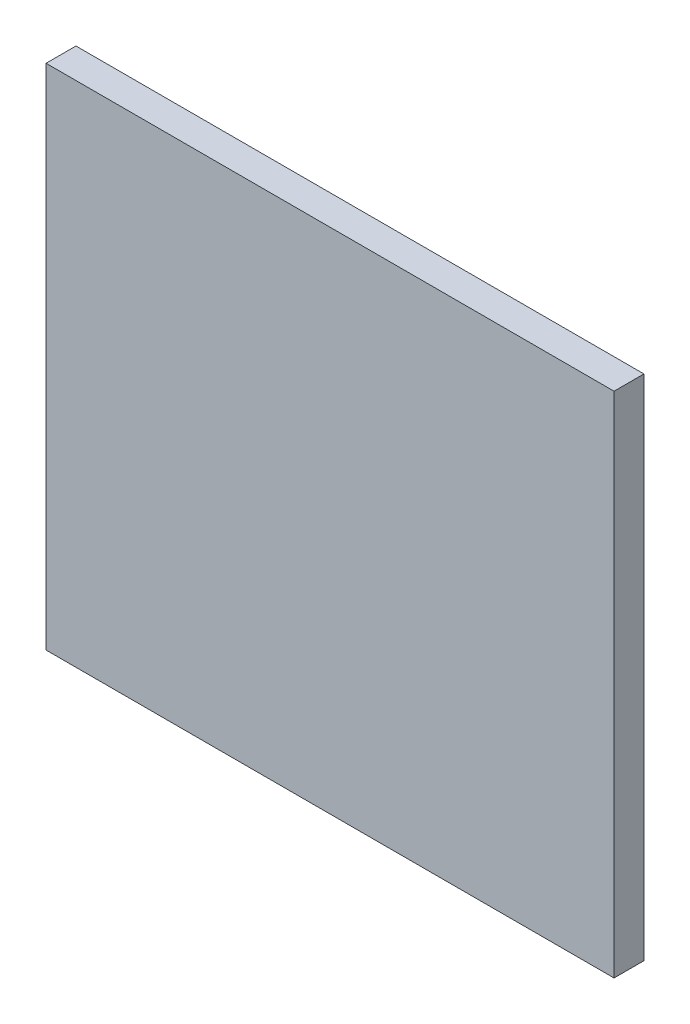
from build123d import *

# Parameters (mm, degrees)
SKETCH1_W           = 190
SKETCH1_H           = 170
BOSS_EXTRUDE1_DEPTH = 10


with BuildPart() as part:
    # Sketch1 → Boss-Extrude1 (new body)
    with BuildSketch(Plane.XY):
        Rectangle(SKETCH1_W, SKETCH1_H)
    extrude(amount=BOSS_EXTRUDE1_DEPTH)


solid = part.part
